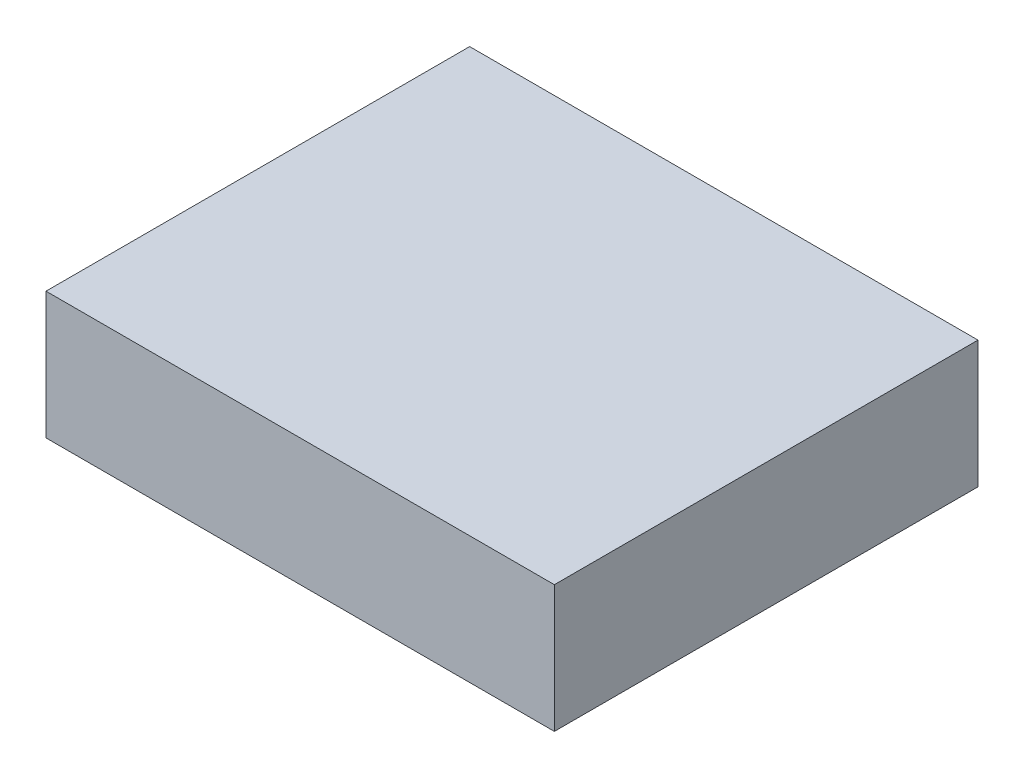
from build123d import *

# Parameters (mm, degrees)
SKETCH1_W           = 60
SKETCH1_H           = 50
BOSS_EXTRUDE1_DEPTH = 15


with BuildPart() as part:
    # Sketch1 → Boss-Extrude1 (new body)
    with BuildSketch(Plane(origin=(0, 0, 0), x_dir=(1, 0, 0), z_dir=(0, 1, 0))):
        with Locations((30, 25)):
            Rectangle(SKETCH1_W, SKETCH1_H)
    extrude(amount=BOSS_EXTRUDE1_DEPTH)


solid = part.part
